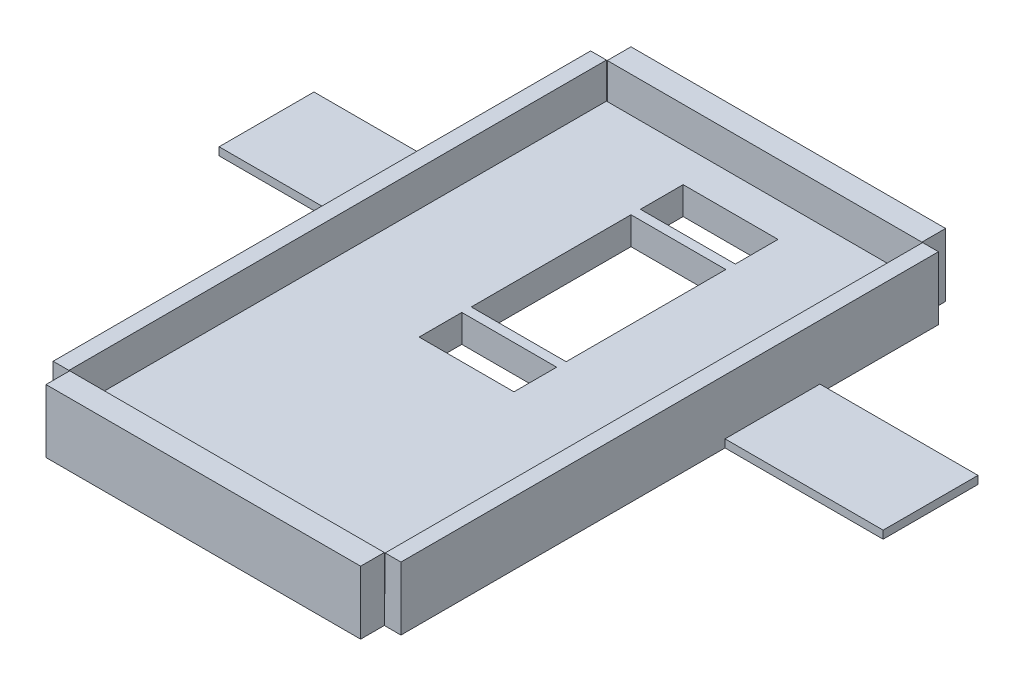
from build123d import *

# Parameters (mm, degrees)
BOSS_EXTRUDE1_DEPTH = 1.75
SKETCH4_W           = 1
SKETCH4_H           = 34
SKETCH4_W_2         = 19.9
SKETCH4_H_2         = 1.5
BOSS_EXTRUDE3_DEPTH = 4
SKETCH7_W           = 6
SKETCH7_H           = 0.5
BOSS_EXTRUDE5_DEPTH = 10
SKETCH9_W           = 6
SKETCH9_H           = 0.5
BOSS_EXTRUDE6_DEPTH = 10


with BuildPart() as part:
    # Sketch2 → Boss-Extrude1 (new body)
    with BuildSketch(Plane(origin=(0, 0, 0), x_dir=(1, 0, 0), z_dir=(0, 1, 0))):
        Polygon((0, 14.85), (0, 17), (-10, 17), (-10, 0), (-3, 0), (-3, 0.85), (0, 0.85), (0, 1.45), (-3, 1.45), (-3, 11.55), (0, 11.55), (0, 12.15), (-3, 12.15), (-3, 14.85), align=None)
        Polygon((-3, 0), (-10, 0), (-10, -17), (0, -17), (0, -1.85), (-3, -1.85), align=None)
        Polygon((10, -17), (10, 0), (3, 0), (3, -1.85), (0, -1.85), (0, -17), align=None)
        Polygon((10, 17), (0, 17), (0, 14.85), (3, 14.85), (3, 12.15), (0, 12.15), (0, 11.55), (3, 11.55), (3, 1.45), (0, 1.45), (0, 0.85), (3, 0.85), (3, 0), (10, 0), align=None)
    extrude(amount=BOSS_EXTRUDE1_DEPTH)

    # Sketch4 → Boss-Extrude3 (add)
    with BuildSketch(Plane(origin=(0, 0, 0), x_dir=(1, 0, 0), z_dir=(0, 1, 0))):
        with Locations((-10.5, 0)):
            Rectangle(SKETCH4_W, SKETCH4_H)
        with Locations((10.5, 0)):
            Rectangle(SKETCH4_W, SKETCH4_H)
        with Locations((0, 17.75)):
            Rectangle(SKETCH4_W_2, SKETCH4_H_2)
        with Locations((0, -17.75)):
            Rectangle(SKETCH4_W_2, SKETCH4_H_2)
    extrude(amount=BOSS_EXTRUDE3_DEPTH)

    # Sketch7 → Boss-Extrude5 (add)
    with BuildSketch(Plane.ZY.offset(11)):
        with Locations((-6.5, 0.25)):
            Rectangle(SKETCH7_W, SKETCH7_H)
    extrude(amount=BOSS_EXTRUDE5_DEPTH)

    # Sketch9 → Boss-Extrude6 (add)
    with BuildSketch(Plane(origin=(11, 0, 0), x_dir=(0, 0, -1), z_dir=(1, 0, 0))):
        with Locations((6.5, 0.25)):
            Rectangle(SKETCH9_W, SKETCH9_H)
    extrude(amount=BOSS_EXTRUDE6_DEPTH)


solid = part.part
